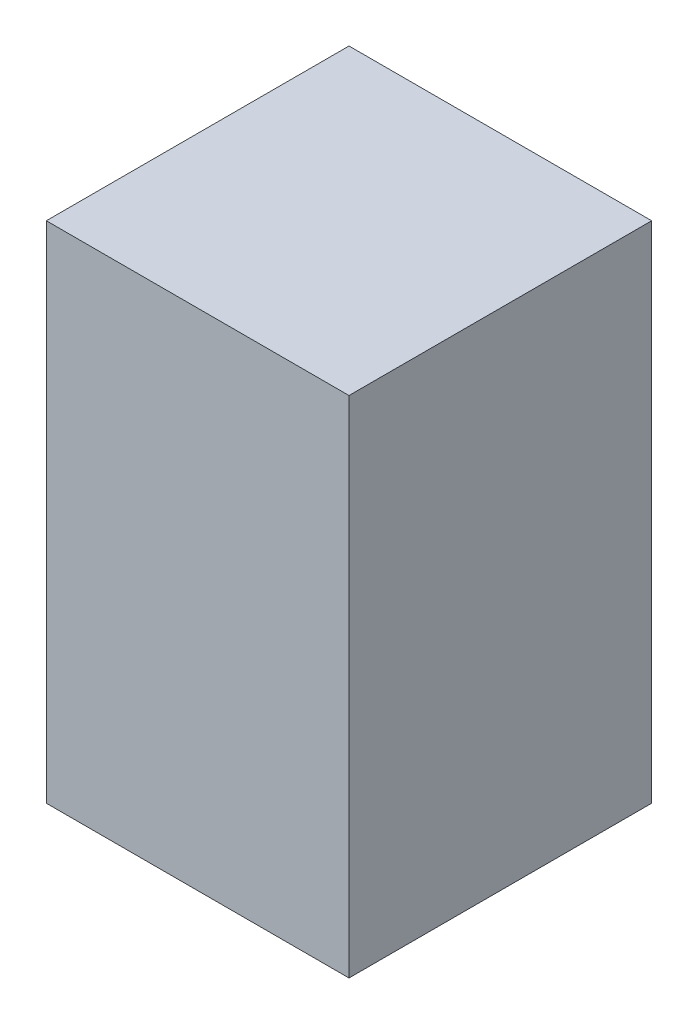
from build123d import *

# Parameters (mm, degrees)
SKETCH1_W           = 30
SKETCH1_H           = 30
BOSS_EXTRUDE1_DEPTH = 50


with BuildPart() as part:
    # Sketch1 → Boss-Extrude1 (new body)
    with BuildSketch(Plane(origin=(0, 0, 0), x_dir=(1, 0, 0), z_dir=(0, 1, 0))):
        Rectangle(SKETCH1_W, SKETCH1_H)
    extrude(amount=BOSS_EXTRUDE1_DEPTH)


solid = part.part
